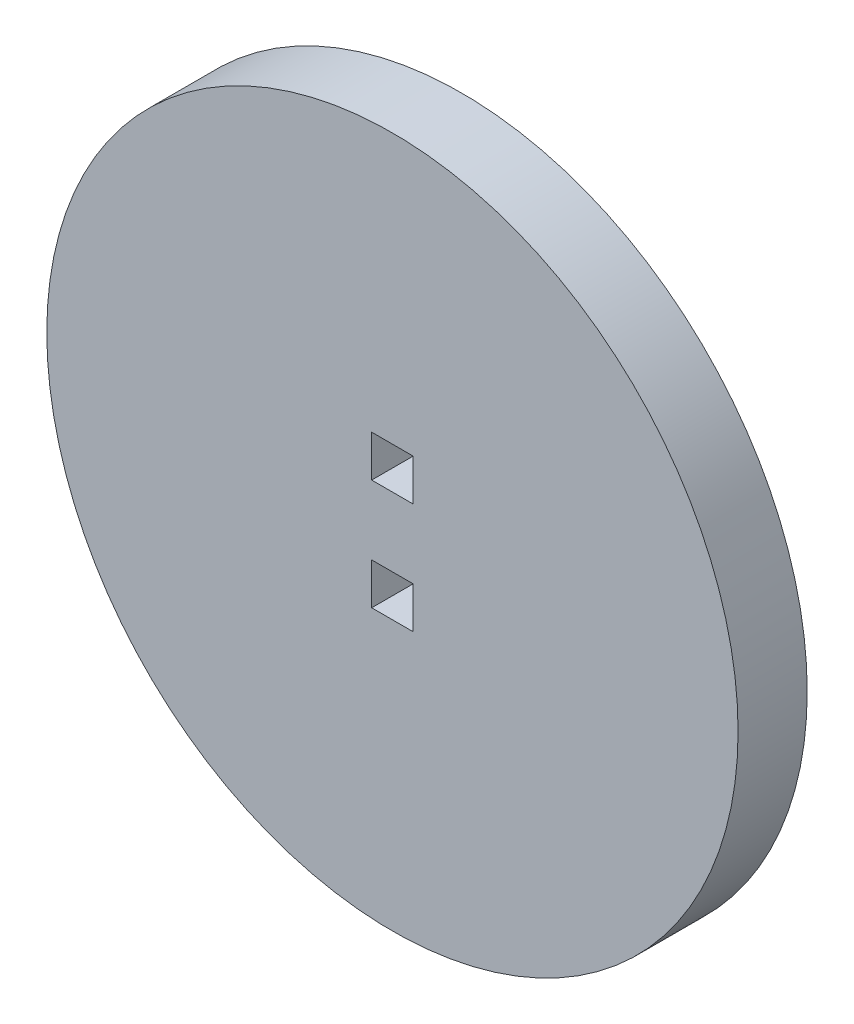
from build123d import *

# Parameters (mm, degrees)
SKETCH1_R           = 25
BOSS_EXTRUDE1_DEPTH = 5
SKETCH2_W           = 3
SKETCH2_H           = 3
CUT_EXTRUDE1_DEPTH  = 36.707142143


with BuildPart() as part:
    # Sketch1 → Boss-Extrude1 (new body)
    with BuildSketch(Plane.XY):
        Circle(SKETCH1_R)
    extrude(amount=BOSS_EXTRUDE1_DEPTH)

    # Sketch2 → Cut-Extrude1 (cut, through all)
    with BuildSketch(Plane.XY.offset(5)):
        with Locations((0, -4)):
            Rectangle(SKETCH2_W, SKETCH2_H)
        with Locations((0, 4)):
            Rectangle(SKETCH2_W, SKETCH2_H)
    extrude(amount=-CUT_EXTRUDE1_DEPTH, mode=Mode.SUBTRACT)


solid = part.part
